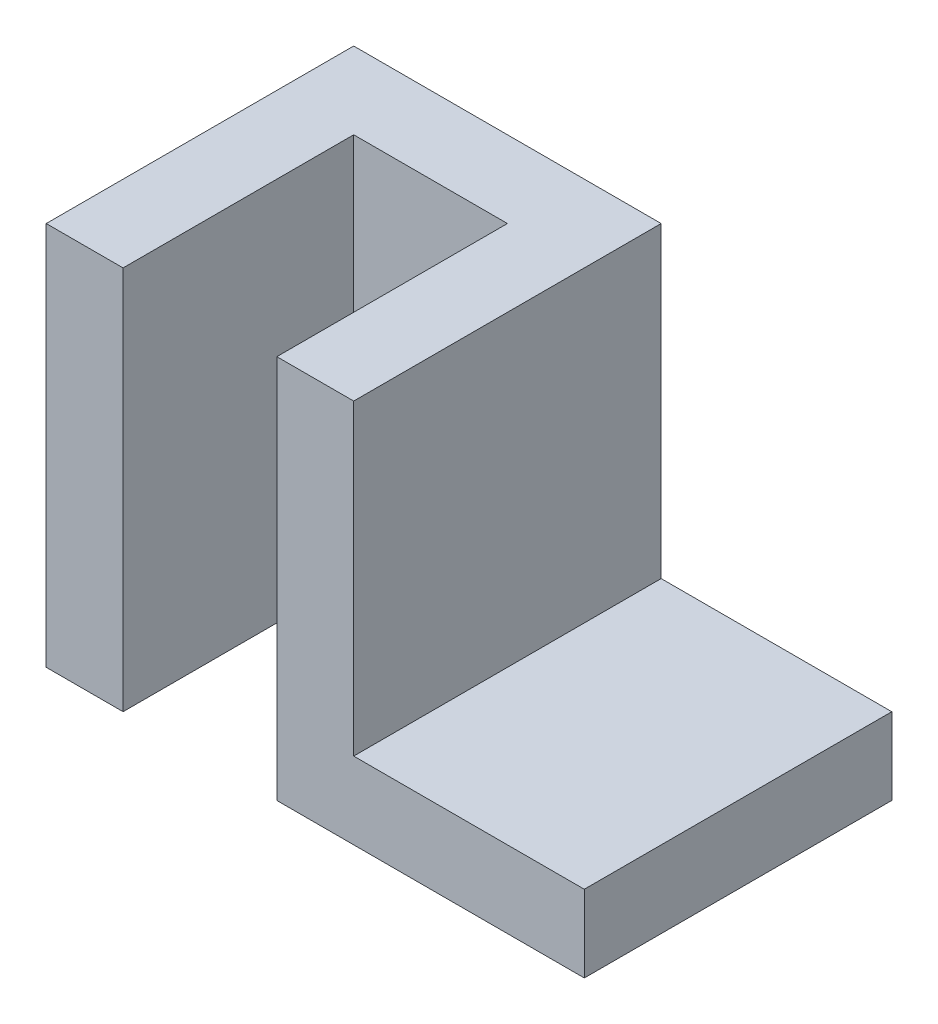
from build123d import *

# Parameters (mm, degrees)
SKETCH1_W           = 70
SKETCH1_H           = 40
BOSS_EXTRUDE1_DEPTH = 10
SKETCH2_W           = 40
SKETCH2_H           = 40
BOSS_EXTRUDE2_DEPTH = 40
SKETCH3_W           = 20
SKETCH3_H           = 30
CUT_EXTRUDE1_DEPTH  = 65.226162893


with BuildPart() as part:
    # Sketch1 → Boss-Extrude1 (new body)
    with BuildSketch(Plane(origin=(0, 0, 0), x_dir=(1, 0, 0), z_dir=(0, 1, 0))):
        Rectangle(SKETCH1_W, SKETCH1_H)
    extrude(amount=BOSS_EXTRUDE1_DEPTH)

    # Sketch2 → Boss-Extrude2 (add)
    with BuildSketch(Plane(origin=(0, 10, 0), x_dir=(1, 0, 0), z_dir=(0, 1, 0))):
        with Locations((-15, 0)):
            Rectangle(SKETCH2_W, SKETCH2_H)
    extrude(amount=BOSS_EXTRUDE2_DEPTH)

    # Sketch3 → Cut-Extrude1 (cut, through all)
    with BuildSketch(Plane(origin=(0, 50, 0), x_dir=(1, 0, 0), z_dir=(0, 1, 0))):
        with Locations((-15, -5)):
            Rectangle(SKETCH3_W, SKETCH3_H)
    extrude(amount=-CUT_EXTRUDE1_DEPTH, mode=Mode.SUBTRACT)


solid = part.part
